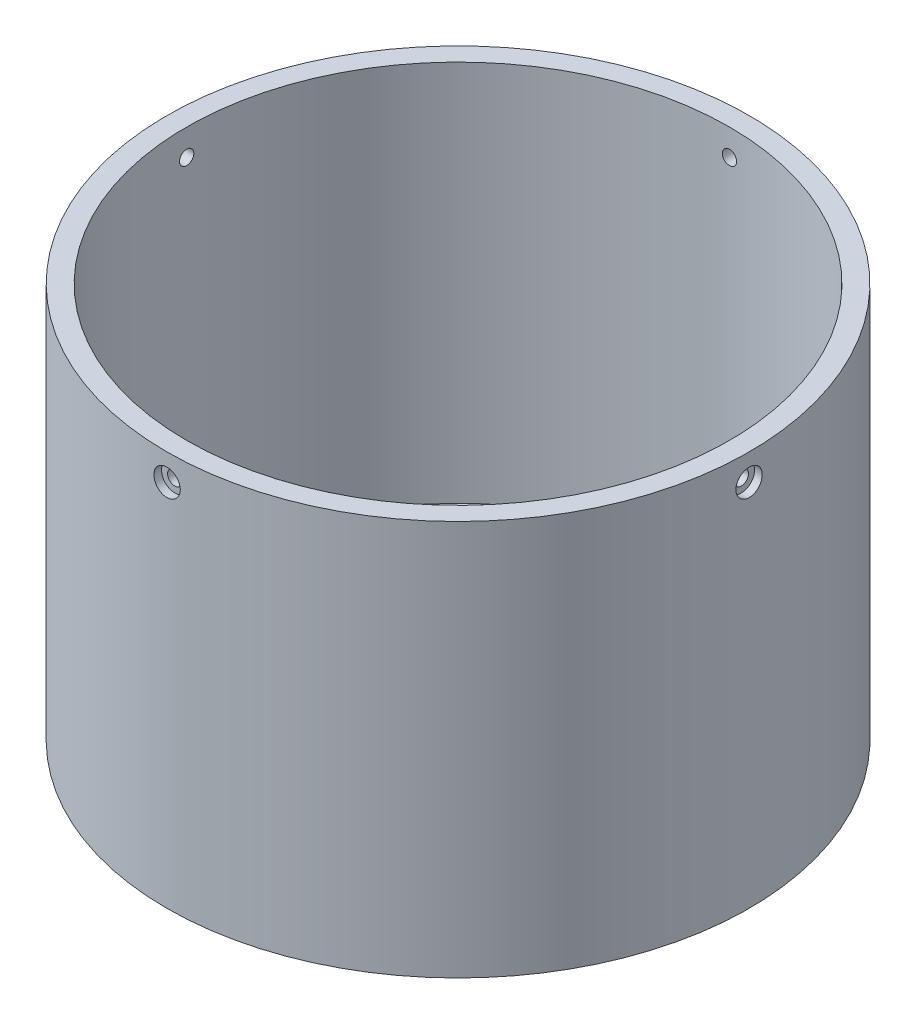
from build123d import *

# Parameters (mm, degrees)
SCHIZZO1_R                                           = 110.5
SCHIZZO1_R_2                                         = 103
ESTRUSIONE_ESTRUSIONE1_DEPTH                         = 150
FORO_LAMATO_PER_BULLONE_M12_A_TESTA_ESAG_D           = 5.4
FORO_LAMATO_PER_BULLONE_M12_A_TESTA_ESAG_DEPTH       = 8.1
FORO_LAMATO_PER_BULLONE_M12_A_TESTA_ESAG_CBORE_D     = 10
FORO_LAMATO_PER_BULLONE_M12_A_TESTA_ESAG_CBORE_DEPTH = 3
FORO_LAMATO_PER_BULLONE_M12_A_TESTA_ESAG_TIP         = 1.622323671
FORO_LAMATO_PER_BULLONE_M12_A_TESTA_2_D              = 5.4
FORO_LAMATO_PER_BULLONE_M12_A_TESTA_2_DEPTH          = 8.1
FORO_LAMATO_PER_BULLONE_M12_A_TESTA_2_CBORE_D        = 10
FORO_LAMATO_PER_BULLONE_M12_A_TESTA_2_CBORE_DEPTH    = 3
FORO_LAMATO_PER_BULLONE_M12_A_TESTA_2_TIP            = 1.622323671
FORO_LAMATO_PER_BULLONE_M12_A_TESTA_3_D              = 5.4
FORO_LAMATO_PER_BULLONE_M12_A_TESTA_3_DEPTH          = 8.1
FORO_LAMATO_PER_BULLONE_M12_A_TESTA_3_CBORE_D        = 10
FORO_LAMATO_PER_BULLONE_M12_A_TESTA_3_CBORE_DEPTH    = 3
FORO_LAMATO_PER_BULLONE_M12_A_TESTA_3_TIP            = 1.622323671
FORO_LAMATO_PER_BULLONE_M12_A_TESTA_4_D              = 5.4
FORO_LAMATO_PER_BULLONE_M12_A_TESTA_4_DEPTH          = 8.1
FORO_LAMATO_PER_BULLONE_M12_A_TESTA_4_CBORE_D        = 10
FORO_LAMATO_PER_BULLONE_M12_A_TESTA_4_CBORE_DEPTH    = 3
FORO_LAMATO_PER_BULLONE_M12_A_TESTA_4_TIP            = 1.622323671
SCHIZZO4_R                                           = 103
SCHIZZO4_R_2                                         = 73
ESTRUSIONE_ESTRUSIONE2_DEPTH                         = 5
FORO_PER_VITE_M6_1_D                                 = 6.6


with BuildPart() as part:
    # Schizzo1 → Estrusione-Estrusione1 (new body)
    with BuildSketch(Plane(origin=(0, 0, 0), x_dir=(1, 0, 0), z_dir=(0, 1, 0))):
        with Locations(Location((0, 0, 0), (0, 0, 270))):
            Circle(SCHIZZO1_R)
        with Locations(Location((0, 0, 0), (0, 0, 270))):
            Circle(SCHIZZO1_R_2, mode=Mode.SUBTRACT)
    extrude(amount=ESTRUSIONE_ESTRUSIONE1_DEPTH)

    # Foro lamato per Bullone M12 a testa esagonale (Classe superiore)-1
    with Locations(Plane(origin=(0, 140, 110.5), x_dir=(1, 0, 0), z_dir=(0, 0, 1))):
        with Locations((0, 0)):
            CounterBoreHole(FORO_LAMATO_PER_BULLONE_M12_A_TESTA_ESAG_D / 2, FORO_LAMATO_PER_BULLONE_M12_A_TESTA_ESAG_CBORE_D / 2, FORO_LAMATO_PER_BULLONE_M12_A_TESTA_ESAG_CBORE_DEPTH, depth=FORO_LAMATO_PER_BULLONE_M12_A_TESTA_ESAG_DEPTH)
            with Locations((0, 0, -(FORO_LAMATO_PER_BULLONE_M12_A_TESTA_ESAG_DEPTH + FORO_LAMATO_PER_BULLONE_M12_A_TESTA_ESAG_TIP / 2))):  # 118° drill point
                Cone(0, FORO_LAMATO_PER_BULLONE_M12_A_TESTA_ESAG_D / 2, FORO_LAMATO_PER_BULLONE_M12_A_TESTA_ESAG_TIP, mode=Mode.SUBTRACT)

    # Foro lamato per Bullone M12 a testa  2
    with Locations(Plane(origin=(110.5, 140, 0), x_dir=(0, 0, 1), z_dir=(1, 0, 0))):
        with Locations((0, 0)):
            CounterBoreHole(FORO_LAMATO_PER_BULLONE_M12_A_TESTA_2_D / 2, FORO_LAMATO_PER_BULLONE_M12_A_TESTA_2_CBORE_D / 2, FORO_LAMATO_PER_BULLONE_M12_A_TESTA_2_CBORE_DEPTH, depth=FORO_LAMATO_PER_BULLONE_M12_A_TESTA_2_DEPTH)
            with Locations((0, 0, -(FORO_LAMATO_PER_BULLONE_M12_A_TESTA_2_DEPTH + FORO_LAMATO_PER_BULLONE_M12_A_TESTA_2_TIP / 2))):  # 118° drill point
                Cone(0, FORO_LAMATO_PER_BULLONE_M12_A_TESTA_2_D / 2, FORO_LAMATO_PER_BULLONE_M12_A_TESTA_2_TIP, mode=Mode.SUBTRACT)

    # Foro lamato per Bullone M12 a testa  3
    with Locations(Plane(origin=(0, 140, -110.5), x_dir=(-1, 0, 0), z_dir=(0, 0, -1))):
        with Locations((0, 0)):
            CounterBoreHole(FORO_LAMATO_PER_BULLONE_M12_A_TESTA_3_D / 2, FORO_LAMATO_PER_BULLONE_M12_A_TESTA_3_CBORE_D / 2, FORO_LAMATO_PER_BULLONE_M12_A_TESTA_3_CBORE_DEPTH, depth=FORO_LAMATO_PER_BULLONE_M12_A_TESTA_3_DEPTH)
            with Locations((0, 0, -(FORO_LAMATO_PER_BULLONE_M12_A_TESTA_3_DEPTH + FORO_LAMATO_PER_BULLONE_M12_A_TESTA_3_TIP / 2))):  # 118° drill point
                Cone(0, FORO_LAMATO_PER_BULLONE_M12_A_TESTA_3_D / 2, FORO_LAMATO_PER_BULLONE_M12_A_TESTA_3_TIP, mode=Mode.SUBTRACT)

    # Foro lamato per Bullone M12 a testa  4
    with Locations(Plane(origin=(-110.5, 140, 0), x_dir=(0, 0, -1), z_dir=(-1, 0, 0))):
        with Locations((0, 0)):
            CounterBoreHole(FORO_LAMATO_PER_BULLONE_M12_A_TESTA_4_D / 2, FORO_LAMATO_PER_BULLONE_M12_A_TESTA_4_CBORE_D / 2, FORO_LAMATO_PER_BULLONE_M12_A_TESTA_4_CBORE_DEPTH, depth=FORO_LAMATO_PER_BULLONE_M12_A_TESTA_4_DEPTH)
            with Locations((0, 0, -(FORO_LAMATO_PER_BULLONE_M12_A_TESTA_4_DEPTH + FORO_LAMATO_PER_BULLONE_M12_A_TESTA_4_TIP / 2))):  # 118° drill point
                Cone(0, FORO_LAMATO_PER_BULLONE_M12_A_TESTA_4_D / 2, FORO_LAMATO_PER_BULLONE_M12_A_TESTA_4_TIP, mode=Mode.SUBTRACT)

    # Schizzo4 → Estrusione-Estrusione2 (add)
    with BuildSketch(Plane.XZ):
        with Locations(Location((0, 0, 0), (0, 0, 270))):
            Circle(SCHIZZO4_R)
        with Locations(Location((0, 0, 0), (0, 0, 270))):
            Circle(SCHIZZO4_R_2, mode=Mode.SUBTRACT)
    extrude(amount=-ESTRUSIONE_ESTRUSIONE2_DEPTH)

    # Foro per Vite M6-1 (through all)
    with Locations(Plane(origin=(0, 5, 0), x_dir=(1, 0, 0), z_dir=(0, 1, 0))):
        with Locations((0, -88), (-88, 0), (88, 0), (0, 88)):
            Hole(FORO_PER_VITE_M6_1_D / 2)


solid = part.part
